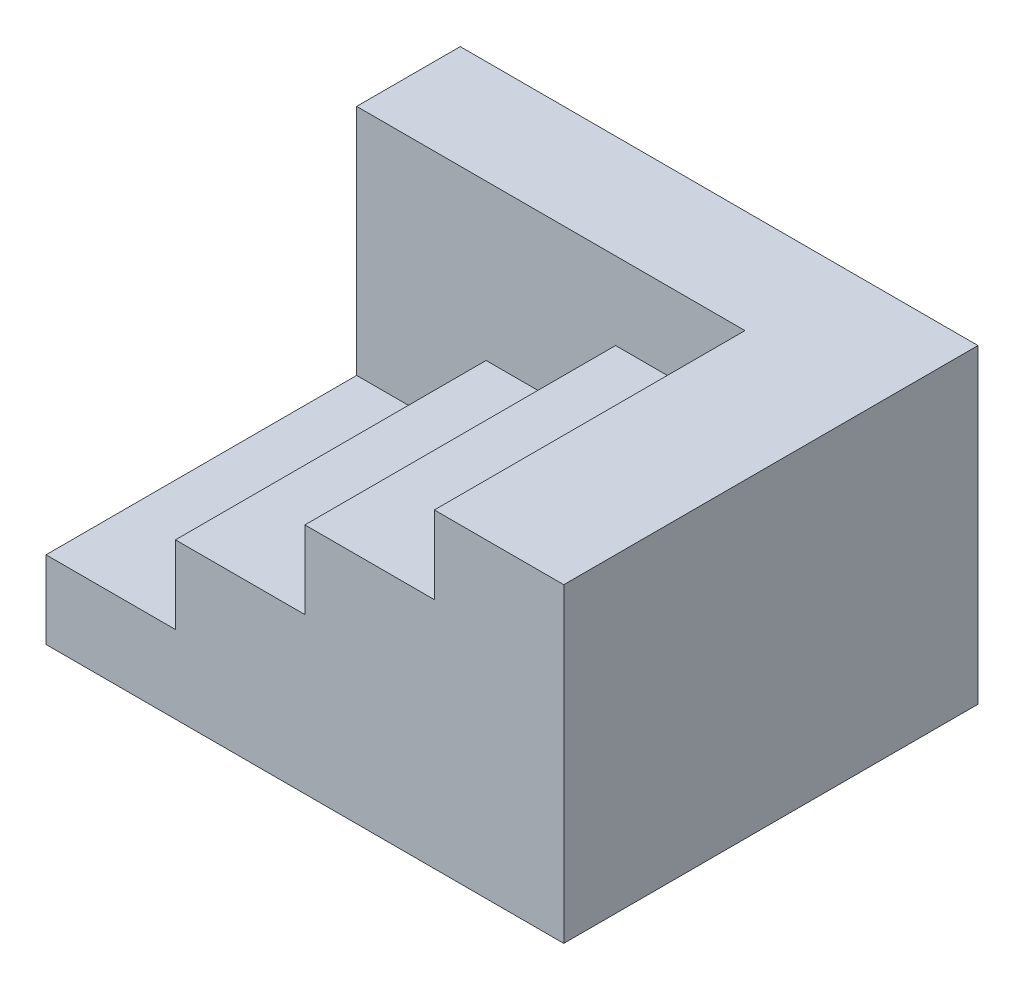
from build123d import *

# Parameters (mm, degrees)
SKETCH1_W           = 100
SKETCH1_H           = 80
BOSS_EXTRUDE2_DEPTH = 60
CUT_EXTRUDE3_DEPTH  = 60


with BuildPart() as part:
    # Sketch1 → Boss-Extrude2 (new body)
    with BuildSketch(Plane(origin=(0, 0, 0), x_dir=(1, 0, 0), z_dir=(0, 1, 0))):
        Rectangle(SKETCH1_W, SKETCH1_H)
    extrude(amount=BOSS_EXTRUDE2_DEPTH)

    # Sketch3 → Cut-Extrude3 (cut)
    with BuildSketch(Plane.XY.offset(40)):
        Polygon((25, 45), (25, 60), (-50, 60), (-50, 15), (-25, 15), (-25, 30), (0, 30), (0, 45), align=None)
    extrude(amount=-CUT_EXTRUDE3_DEPTH, mode=Mode.SUBTRACT)


solid = part.part
